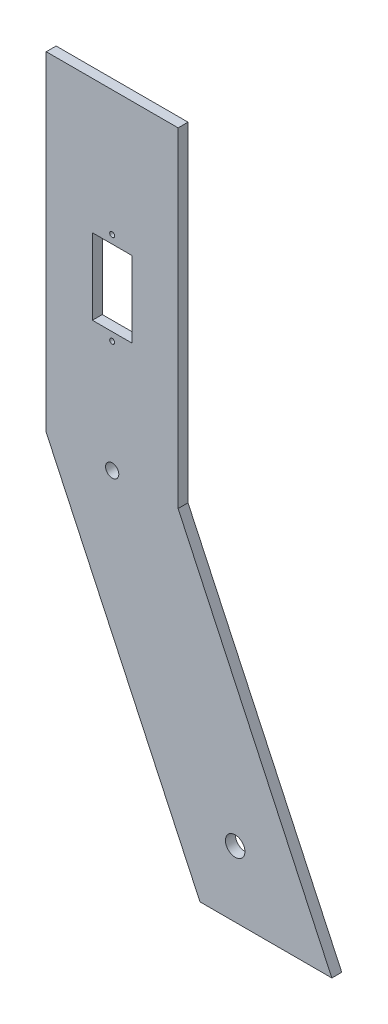
from build123d import *

# Parameters (mm, degrees)
CROQUIS1_R              = 2.95
CROQUIS1_R_2            = 0.75
CROQUIS1_R_3            = 2
CROQUIS1_W              = 12
CROQUIS1_H              = 23
SALIENTE_EXTRUIR1_DEPTH = 3


with BuildPart() as part:
    # Croquis1 → Saliente-Extruir1 (new body)
    with BuildSketch(Plane.XY):
        Polygon((0, 0), (-40, 0), (-86.630765816, 100), (-86.630765816, 200), (-46.630765816, 200), (-46.630765816, 100), align=None)
        with Locations((-29.326153163, 20)):
            Circle(CROQUIS1_R, mode=Mode.SUBTRACT)
        with Locations((-66.630765816, 133.95806763)):
            Circle(CROQUIS1_R_2, mode=Mode.SUBTRACT)
        with Locations((-66.630765816, 161.95806763)):
            Circle(CROQUIS1_R_2, mode=Mode.SUBTRACT)
        with Locations((-66.630765816, 100)):
            Circle(CROQUIS1_R_3, mode=Mode.SUBTRACT)
        with Locations((-66.630765816, 147.95806763)):
            Rectangle(CROQUIS1_W, CROQUIS1_H, mode=Mode.SUBTRACT)
    extrude(amount=SALIENTE_EXTRUIR1_DEPTH)


solid = part.part
